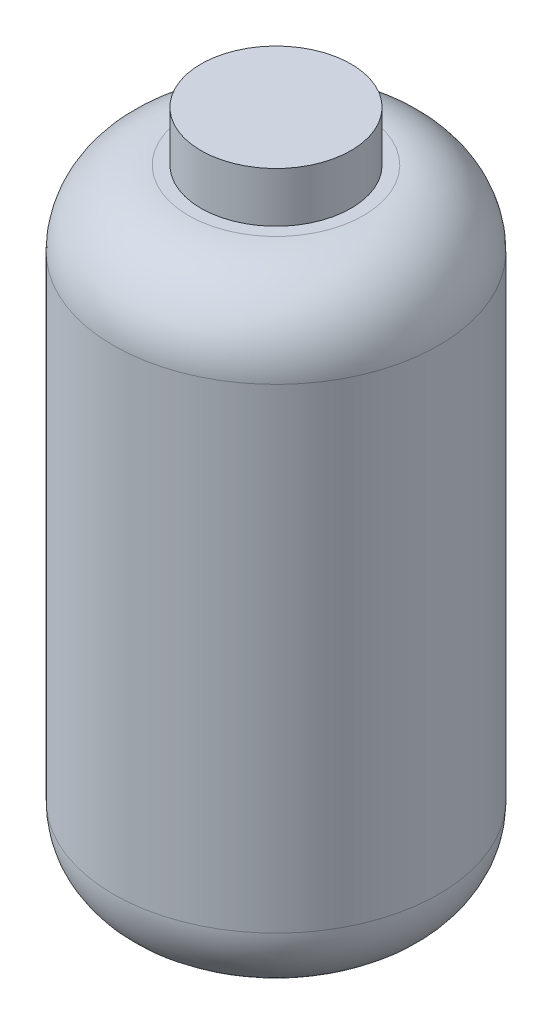
from build123d import *

# Parameters (mm, degrees)
SKETCH1_R           = 32.5
BOSS_EXTRUDE1_DEPTH = 125
FILLET1_R           = 15
SKETCH2_R           = 15
BOSS_EXTRUDE2_DEPTH = 10


with BuildPart() as part:
    # Sketch1 → Boss-Extrude1 (new body)
    with BuildSketch(Plane(origin=(0, 0, 0), x_dir=(1, 0, 0), z_dir=(0, 1, 0))):
        with Locations(Location((0, 0, 0), (0, 0, 270))):
            Circle(SKETCH1_R)
    extrude(amount=BOSS_EXTRUDE1_DEPTH)

    # Fillet1
    fillet1_edges = [part.edges().sort_by_distance(p)[0] for p in [
        (0, 0, -32.5),
        (0, 125, -32.5),
    ]]
    fillet(fillet1_edges, radius=FILLET1_R)


with BuildPart() as body_2:
    # Sketch2 → Boss-Extrude2 (new body)
    with BuildSketch(Plane(origin=(0, 125, 0), x_dir=(1, 0, 0), z_dir=(0, 1, 0))):
        with Locations(Location((0, 0, 0), (0, 0, 270))):
            Circle(SKETCH2_R)
    extrude(amount=BOSS_EXTRUDE2_DEPTH)


solid = Compound([part.part, body_2.part])
